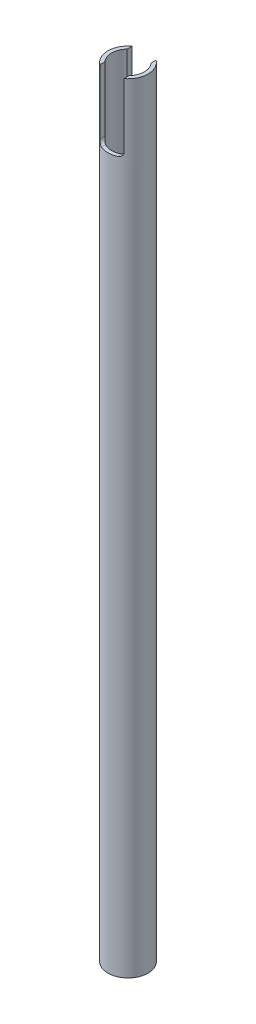
from build123d import *

# Parameters (mm, degrees)
BOSS_EXTRUDE1_START     = -148.161366
SKETCH1_R               = 7.9375
SKETCH1_R_2             = 6.4643
BOSS_EXTRUDE1_DEPTH     = 307.990856341
CUT_EXTRUDE1_DEPTH      = 161.223199928
CUT_EXTRUDE1_DEPTH_BACK = 161.223199928


with BuildPart() as part:
    # Sketch1 → Boss-Extrude1 (new body)
    with BuildSketch(Plane(origin=(0, 0, 0), x_dir=(1, 0, 0), z_dir=(0, 1, 0)).offset(BOSS_EXTRUDE1_START)):
        with Locations(Location((0, 0, 0), (0, 0, 180))):
            Circle(SKETCH1_R)
        with Locations(Location((0, 0, 0), (0, 0, 180))):
            Circle(SKETCH1_R_2, mode=Mode.SUBTRACT)
    extrude(amount=BOSS_EXTRUDE1_DEPTH)

    # Sketch2 → Cut-Extrude1 (cut, two sides: drawn at the far end of the back side and taken through both)
    with BuildSketch(Plane.XY.offset(-CUT_EXTRUDE1_DEPTH_BACK)):
        with BuildLine():
            Line((4.7625, 159.829490671), (-4.7625, 159.829490671))
            Line((-4.7625, 159.829490671), (-4.7625, 134.429490671))
            ThreePointArc((-4.7625, 134.429490671), (-4.297532015, 133.306958655), (-3.175, 132.841990671))
            Line((-3.175, 132.841990671), (3.175, 132.841990671))
            ThreePointArc((3.175, 132.841990671), (4.297532015, 133.306958655), (4.7625, 134.429490671))
            Line((4.7625, 134.429490671), (4.7625, 159.829490671))
        make_face()
    extrude(amount=CUT_EXTRUDE1_DEPTH + CUT_EXTRUDE1_DEPTH_BACK, mode=Mode.SUBTRACT)


solid = part.part
